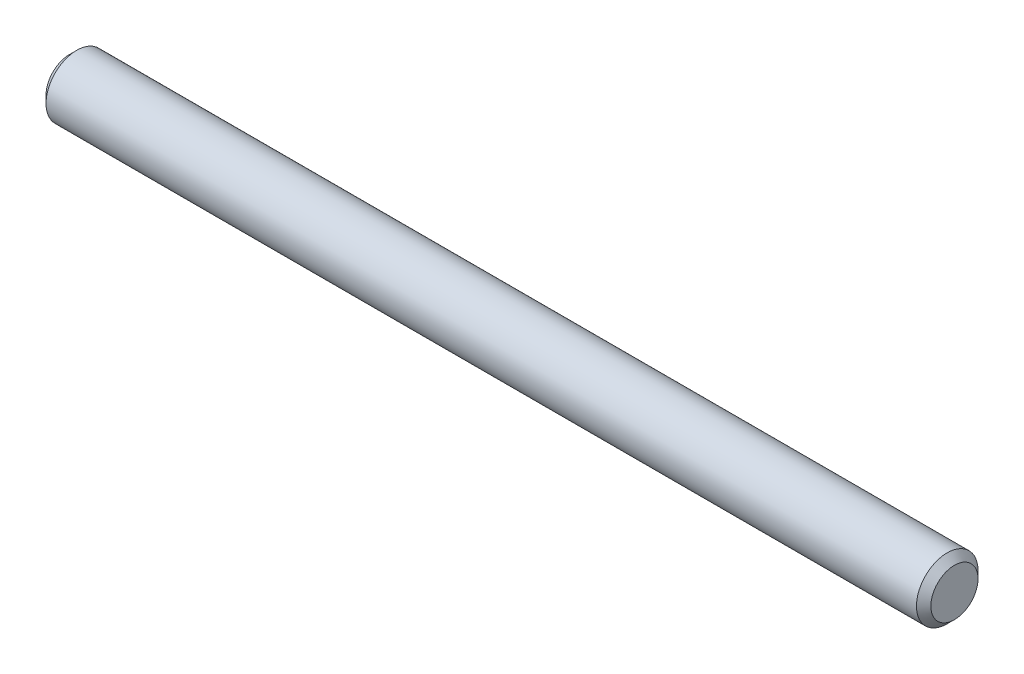
from build123d import *

# Parameters (mm, degrees)
BOSS_EXTRUDE1_DEPTH      = 57.5
BOSS_EXTRUDE1_DEPTH_BACK = 57.5
SKETCH2_R                = 4
CHAMFER1_SIZE            = 0.9375


with BuildPart() as part:
    # Sketch2 → Boss-Extrude1 (new, two sides: drawn at the far end of the back side and taken through both)
    with BuildSketch(Plane(origin=(0, 0, 0), x_dir=(0, 0, -1), z_dir=(1, 0, 0)).offset(-BOSS_EXTRUDE1_DEPTH_BACK)):
        Circle(SKETCH2_R)
    extrude(amount=BOSS_EXTRUDE1_DEPTH + BOSS_EXTRUDE1_DEPTH_BACK)

    # Chamfer1
    chamfer1_edges = [part.edges().sort_by_distance(p)[0] for p in [
        (-57.5, 0, 4),
        (57.5, 0, 4),
    ]]
    chamfer(chamfer1_edges, length=CHAMFER1_SIZE)


solid = part.part
